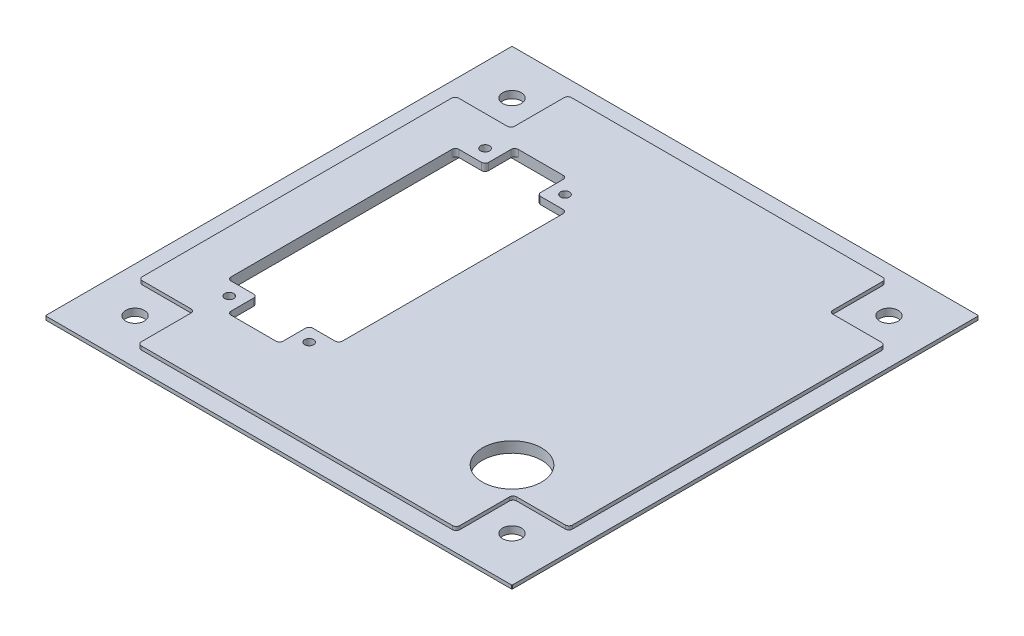
from build123d import *

# Parameters (mm, degrees)
SKETCH_1_W          = 130
SKETCH_1_H          = 130
EXTRUDE_1_DEPTH     = 3
SKETCH_2_R          = 2.6
CUT_EXTRUDE_1_DEPTH = 92.972822073
SKETCH_4_W          = 20.650518397
SKETCH_4_H          = 20.951555191
CUT_EXTRUDE_2_DEPTH = 1
SKETCH_5_W          = 88.698963206
SKETCH_5_H          = 5.1
SKETCH_5_W_2        = 5.1
SKETCH_5_H_2        = 88.096889618
CUT_EXTRUDE_3_DEPTH = 1
CUT_EXTRUDE_4_DEPTH = 3
EXTRUDE_START       = -2
SKETCH_7_R          = 1.25
EXTRUDE_2_DEPTH     = 2
FILLET_1_R          = 1
SKETCH_15_R         = 8.25
CUT_EXTRUDE_9_DEPTH = 92.972822073
CHAMFER_1_SIZE      = 1
CHAMFER_2_SIZE      = 0.2
FILLET_3_R          = 1
FILLET_4_R          = 1


with BuildPart() as part:
    # 草图1 → 凸台-拉伸1 (new body)
    with BuildSketch(Plane(origin=(0, 0, 0), x_dir=(1, 0, 0), z_dir=(0, 1, 0))):
        Rectangle(SKETCH_1_W, SKETCH_1_H)
    extrude(amount=EXTRUDE_1_DEPTH)

    # 草图2 → 切除-拉伸1 (cut, through all)
    with BuildSketch(Plane(origin=(0, 3, 0), x_dir=(1, 0, 0), z_dir=(0, 1, 0))):
        with Locations(Location((52.5, 52.5, 0), (0, 0, 270))):
            Circle(SKETCH_2_R)
        with Locations(Location((52.5, -52.5, 0), (0, 0, 270))):
            Circle(SKETCH_2_R)
        with Locations(Location((-52.5, -52.5, 0), (0, 0, 270))):
            Circle(SKETCH_2_R)
        with Locations(Location((-52.5, 52.5, 0), (0, 0, 270))):
            Circle(SKETCH_2_R)
    extrude(amount=-CUT_EXTRUDE_1_DEPTH, mode=Mode.SUBTRACT)

    # 草图4 → 切除-拉伸2 (cut)
    with BuildSketch(Plane(origin=(0, 3, 0), x_dir=(1, 0, 0), z_dir=(0, 1, 0))):
        with Locations((54.674740802, 54.524222405)):
            Rectangle(SKETCH_4_W, SKETCH_4_H)
        with Locations((-54.674740802, -54.524222405)):
            Rectangle(SKETCH_4_W, SKETCH_4_H)
        with Locations((54.674740802, -54.524222405)):
            Rectangle(SKETCH_4_W, SKETCH_4_H)
        with Locations((-54.674740802, 54.524222405)):
            Rectangle(SKETCH_4_W, SKETCH_4_H)
    extrude(amount=-CUT_EXTRUDE_2_DEPTH, mode=Mode.SUBTRACT)

    # 草图5 → 切除-拉伸3 (cut)
    with BuildSketch(Plane(origin=(0, 3, 0), x_dir=(1, 0, 0), z_dir=(0, 1, 0))):
        with Locations((0, 62.45)):
            Rectangle(SKETCH_5_W, SKETCH_5_H)
        with Locations((62.45, 0)):
            Rectangle(SKETCH_5_W_2, SKETCH_5_H_2)
        with Locations((0, -62.45)):
            Rectangle(SKETCH_5_W, SKETCH_5_H)
        with Locations((-62.45, 0)):
            Rectangle(SKETCH_5_W_2, SKETCH_5_H_2)
    extrude(amount=-CUT_EXTRUDE_3_DEPTH, mode=Mode.SUBTRACT)

    # 草图6 → 切除-拉伸4 (cut)
    with BuildSketch(Plane(origin=(0, 0, 0), x_dir=(-1, 0, 0), z_dir=(0, -1, 0))):
        with BuildLine():
            Line((47.5, -35), (47.5, 35))
            ThreePointArc((47.5, 35), (46.035533906, 38.535533906), (42.5, 40))
            Line((42.5, 40), (21.5, 40))
            ThreePointArc((21.5, 40), (17.964466094, 38.535533906), (16.5, 35))
            Line((16.5, 35), (16.5, -35))
            ThreePointArc((16.5, -35), (17.964466094, -38.535533906), (21.5, -40))
            Line((21.5, -40), (42.5, -40))
            ThreePointArc((42.5, -40), (46.035533906, -38.535533906), (47.5, -35))
        make_face()
    extrude(amount=-CUT_EXTRUDE_4_DEPTH, mode=Mode.SUBTRACT)

    # 草图7 → 凸台-拉伸2 (add)
    # profile 1 of 4: a face of its own
    with BuildSketch(Plane(origin=(0, 3, 0), x_dir=(1, 0, 0), z_dir=(0, 1, 0)).offset(EXTRUDE_START)):
        with BuildLine():
            Line((-24.75, 40), (-24.75, 31.75))
            Line((-24.75, 31.75), (-16.5, 31.75))
            Line((-16.5, 31.75), (-16.5, 35))
            ThreePointArc((-16.5, 35), (-17.964466094, 38.535533906), (-21.5, 40))
            Line((-21.5, 40), (-24.75, 40))
        make_face()
        with Locations(Location((-20.872307757, 35.627692243, 0), (0, 0, 270))):
            Circle(SKETCH_7_R, mode=Mode.SUBTRACT)
    # profile 2 of 4: a face of its own
    with BuildSketch(Plane(origin=(0, 3, 0), x_dir=(1, 0, 0), z_dir=(0, 1, 0)).offset(EXTRUDE_START)):
        with BuildLine():
            Line((-16.5, -31.75), (-24.75, -31.75))
            Line((-24.75, -31.75), (-24.75, -40))
            Line((-24.75, -40), (-21.5, -40))
            ThreePointArc((-21.5, -40), (-17.964466094, -38.535533906), (-16.5, -35))
            Line((-16.5, -35), (-16.5, -31.75))
        make_face()
        with Locations(Location((-20.872307757, -35.627692243, 0), (0, 0, 270))):
            Circle(SKETCH_7_R, mode=Mode.SUBTRACT)
    # profile 3 of 4: a face of its own
    with BuildSketch(Plane(origin=(0, 3, 0), x_dir=(1, 0, 0), z_dir=(0, 1, 0)).offset(EXTRUDE_START)):
        with BuildLine():
            Line((-39.25, -40), (-39.25, -31.75))
            Line((-39.25, -31.75), (-47.5, -31.75))
            Line((-47.5, -31.75), (-47.5, -35))
            ThreePointArc((-47.5, -35), (-46.035533906, -38.535533906), (-42.5, -40))
            Line((-42.5, -40), (-39.25, -40))
        make_face()
        with Locations(Location((-43.127692243, -35.627692243, 0), (0, 0, 270))):
            Circle(SKETCH_7_R, mode=Mode.SUBTRACT)
    # profile 4 of 4: a face of its own
    with BuildSketch(Plane(origin=(0, 3, 0), x_dir=(1, 0, 0), z_dir=(0, 1, 0)).offset(EXTRUDE_START)):
        with BuildLine():
            Line((-47.5, 31.75), (-39.25, 31.75))
            Line((-39.25, 31.75), (-39.25, 40))
            Line((-39.25, 40), (-42.5, 40))
            ThreePointArc((-42.5, 40), (-46.035533906, 38.535533906), (-47.5, 35))
            Line((-47.5, 35), (-47.5, 31.75))
        make_face()
        with Locations(Location((-43.127692243, 35.627692243, 0), (0, 0, 270))):
            Circle(SKETCH_7_R, mode=Mode.SUBTRACT)
    extrude(amount=EXTRUDE_2_DEPTH)

    # 圆角1
    fillet_1_edges = [part.edges().sort_by_distance(p)[0] for p in [
        (-24.75, 2, -31.75),
        (-39.25, 2, -31.75),
        (-39.25, 2, 31.75),
        (-24.75, 2, 31.75),
    ]]
    fillet(fillet_1_edges, radius=FILLET_1_R)

    # 草图15 → 切除-拉伸9 (cut, through all)
    with BuildSketch(Plane(origin=(0, 0, 0), x_dir=(-1, 0, 0), z_dir=(0, -1, 0))):
        with Locations(Location((-37, -37, 0), (0, 0, 90))):
            Circle(SKETCH_15_R)
    extrude(amount=-CUT_EXTRUDE_9_DEPTH, mode=Mode.SUBTRACT)

    # 倒角1
    chamfer_1_edges = [part.edges().sort_by_distance(p)[0] for p in [
        (0, 0, 65),
        (-65, 0, 0),
        (0, 0, -65),
        (65, 0, 0),
    ]]
    chamfer(chamfer_1_edges, length=CHAMFER_1_SIZE)

    # 倒角2
    chamfer_2_edges = [part.edges().sort_by_distance(p)[0] for p in [
        (65, 1.5, 65),
        (-65, 1.5, 65),
        (-65, 1.5, -65),
        (65, 1.5, -65),
    ]]
    chamfer(chamfer_2_edges, length=CHAMFER_2_SIZE)

    # 圆角3
    fillet_3_edges = [part.edges().sort_by_distance(p)[0] for p in [
        (59.9, 2.5, 44.048444809),
        (59.9, 2.5, -44.048444809),
        (-44.349481603, 2.5, -59.9),
        (44.349481603, 2.5, -59.9),
        (44.349481603, 2.5, 59.9),
        (-44.349481603, 2.5, 59.9),
        (-59.9, 2.5, 44.048444809),
        (-59.9, 2.5, -44.048444809),
        (-44.349481603, 2.5, -44.048444809),
        (-44.349481603, 2.5, 44.048444809),
        (44.349481603, 2.5, 44.048444809),
        (44.349481603, 2.5, -44.048444809),
    ]]
    fillet(fillet_3_edges, radius=FILLET_3_R)

    # 圆角4
    fillet_4_edges = [part.edges().sort_by_distance(p)[0] for p in [
        (-24.75, 2, -40),
        (-16.5, 2, -31.75),
        (-47.5, 2, -31.75),
        (-39.25, 2, -40),
        (-39.25, 2, 40),
        (-47.5, 2, 31.75),
        (-16.5, 2, 31.75),
        (-24.75, 2, 40),
    ]]
    fillet(fillet_4_edges, radius=FILLET_4_R)


solid = part.part
